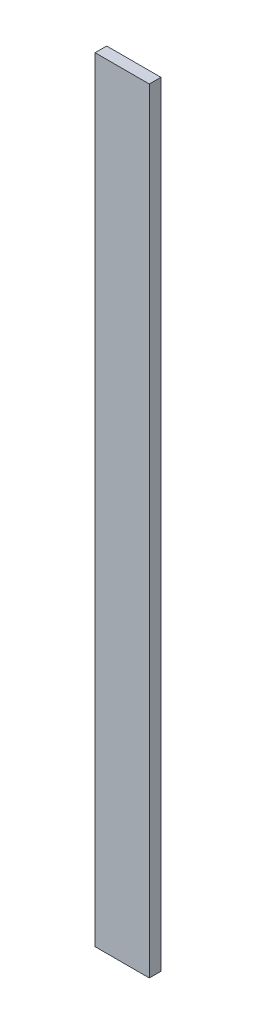
from build123d import *

# Parameters (mm, degrees)
SKETCH3_W           = 70
SKETCH3_H           = 1000
BOSS_EXTRUDE1_DEPTH = 15
SKETCH4_R           = 10
CUT_EXTRUDE1_DEPTH  = 8


with BuildPart() as part:
    # Sketch3 → Boss-Extrude1 (new body)
    with BuildSketch(Plane.XY):
        with Locations((-35, -500)):
            Rectangle(SKETCH3_W, SKETCH3_H)
    extrude(amount=BOSS_EXTRUDE1_DEPTH)

    # Sketch4 → Cut-Extrude1 (cut)
    with BuildSketch(Plane(origin=(0, 0, 0), x_dir=(-1, 0, 0), z_dir=(0, 0, -1))):
        with Locations((35, -30)):
            Circle(SKETCH4_R)
        with Locations((35, -180)):
            Circle(SKETCH4_R)
        with Locations((35, -330)):
            Circle(SKETCH4_R)
        with Locations((35, -480)):
            Circle(SKETCH4_R)
        with Locations((35, -630)):
            Circle(SKETCH4_R)
        with Locations((35, -780)):
            Circle(SKETCH4_R)
        with Locations((35, -930)):
            Circle(SKETCH4_R)
    extrude(amount=-CUT_EXTRUDE1_DEPTH, mode=Mode.SUBTRACT)


solid = part.part
